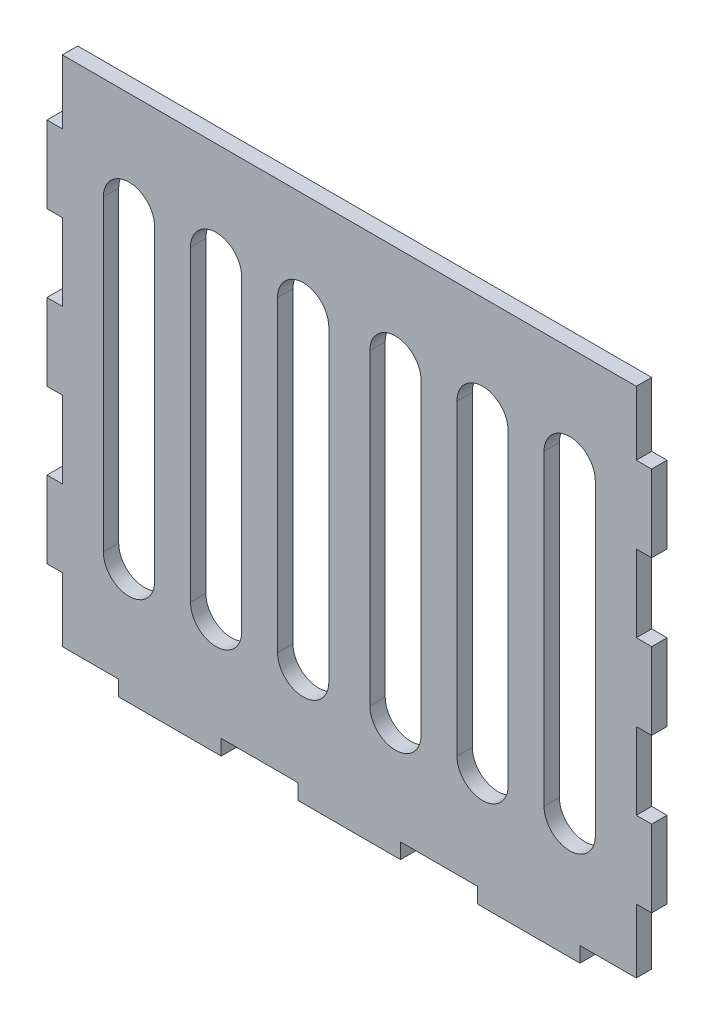
from build123d import *

# Parameters (mm, degrees)
SKETCH1_W           = 3
SKETCH1_H           = 15
SKETCH1_W_2         = 112
SKETCH1_H_2         = 100
SKETCH1_W_3         = 20
SKETCH1_H_3         = 3
BOSS_EXTRUDE1_DEPTH = 3


with BuildPart() as part:
    # Sketch1 → Boss-Extrude1 (new body)
    # profile 1 of 10: a face of its own
    with BuildSketch(Plane.XY):
        with Locations((-57.5, 30)):
            Rectangle(SKETCH1_W, SKETCH1_H)
    # profile 2 of 10: a face of its own
    with BuildSketch(Plane.XY):
        Rectangle(SKETCH1_W_2, SKETCH1_H_2)
        with BuildLine():
            ThreePointArc((-4, 30), (-9, 35), (-14, 30))
            Line((-14, 30), (-14, -30))
            ThreePointArc((-14, -30), (-9, -35), (-4, -30))
            Line((-4, -30), (-4, 30))
        make_face(mode=Mode.SUBTRACT)
        with BuildLine():
            ThreePointArc((-21, 30), (-26, 35), (-31, 30))
            Line((-31, 30), (-31, -30))
            ThreePointArc((-31, -30), (-26, -35), (-21, -30))
            Line((-21, -30), (-21, 30))
        make_face(mode=Mode.SUBTRACT)
        with BuildLine():
            ThreePointArc((-38, 30), (-43, 35), (-48, 30))
            Line((-48, 30), (-48, -30))
            ThreePointArc((-48, -30), (-43, -35), (-38, -30))
            Line((-38, -30), (-38, 30))
        make_face(mode=Mode.SUBTRACT)
        with BuildLine():
            Line((4, -30), (4, 30))
            ThreePointArc((4, 30), (9, 35), (14, 30))
            Line((14, 30), (14, -30))
            ThreePointArc((14, -30), (9, -35), (4, -30))
        make_face(mode=Mode.SUBTRACT)
        with BuildLine():
            Line((21, -30), (21, 30))
            ThreePointArc((21, 30), (26, 35), (31, 30))
            Line((31, 30), (31, -30))
            ThreePointArc((31, -30), (26, -35), (21, -30))
        make_face(mode=Mode.SUBTRACT)
        with BuildLine():
            Line((38, -30), (38, 30))
            ThreePointArc((38, 30), (43, 35), (48, 30))
            Line((48, 30), (48, -30))
            ThreePointArc((48, -30), (43, -35), (38, -30))
        make_face(mode=Mode.SUBTRACT)
    # profile 3 of 10: a face of its own
    with BuildSketch(Plane.XY):
        with Locations((-57.5, 0)):
            Rectangle(SKETCH1_W, SKETCH1_H)
    # profile 4 of 10: a face of its own
    with BuildSketch(Plane.XY):
        with Locations((-35, -51.5)):
            Rectangle(SKETCH1_W_3, SKETCH1_H_3)
    # profile 5 of 10: a face of its own
    with BuildSketch(Plane.XY):
        with Locations((0, -51.5)):
            Rectangle(SKETCH1_W_3, SKETCH1_H_3)
    # profile 6 of 10: a face of its own
    with BuildSketch(Plane.XY):
        with Locations((35, -51.5)):
            Rectangle(SKETCH1_W_3, SKETCH1_H_3)
    # profile 7 of 10: a face of its own
    with BuildSketch(Plane.XY):
        with Locations((57.5, 0)):
            Rectangle(SKETCH1_W, SKETCH1_H)
    # profile 8 of 10: a face of its own
    with BuildSketch(Plane.XY):
        with Locations((57.5, 30)):
            Rectangle(SKETCH1_W, SKETCH1_H)
    # profile 9 of 10: a face of its own
    with BuildSketch(Plane.XY):
        with Locations((-57.5, -30)):
            Rectangle(SKETCH1_W, SKETCH1_H)
    # profile 10 of 10: a face of its own
    with BuildSketch(Plane.XY):
        with Locations((57.5, -30)):
            Rectangle(SKETCH1_W, SKETCH1_H)
    extrude(amount=BOSS_EXTRUDE1_DEPTH)


solid = part.part
